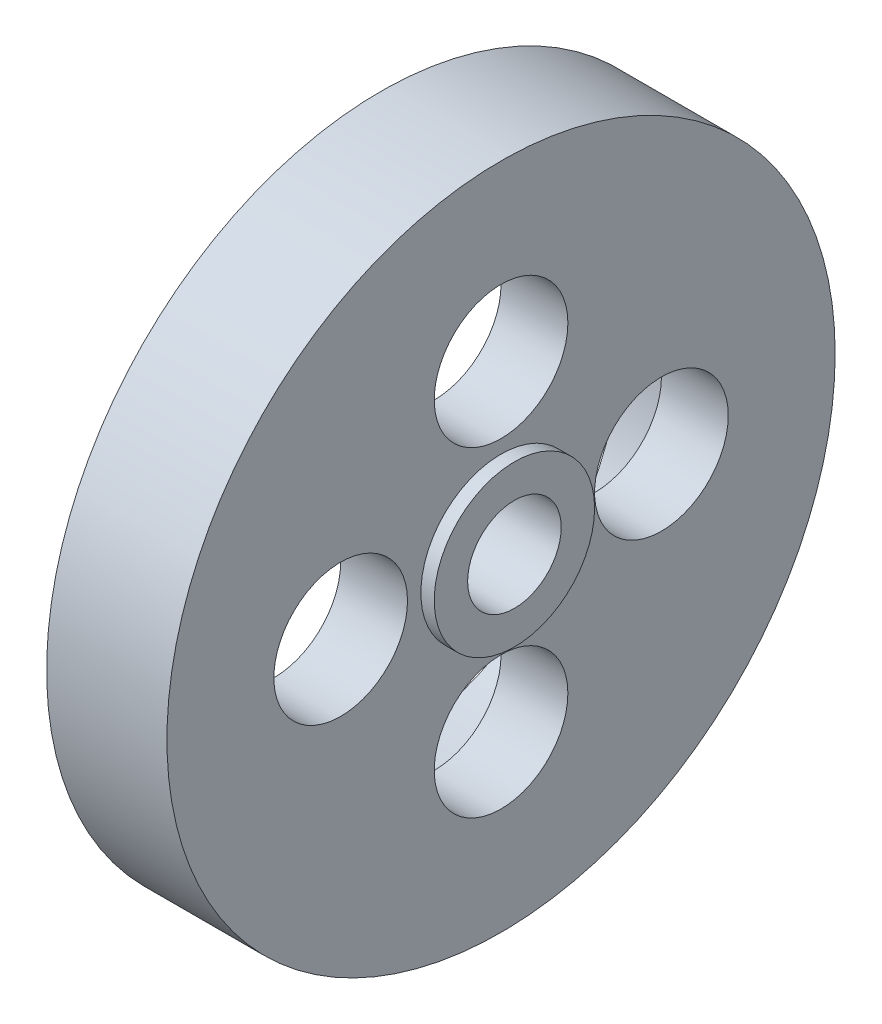
from build123d import *

# Parameters (mm, degrees)
SKETCH1_R           = 25
SKETCH1_R_2         = 3.5
BOSS_EXTRUDE1_DEPTH = 10
CUT_EXTRUDE2_START  = -1
SKETCH2_R           = 25
SKETCH2_R_2         = 6
CUT_EXTRUDE2_DEPTH  = 1
SKETCH3_R           = 5
CUT_EXTRUDE3_DEPTH  = 37.482872694
SKETCH4_R           = 18
CUT_EXTRUDE4_DEPTH  = 4


with BuildPart() as part:
    # Sketch1 → Boss-Extrude1 (new body)
    with BuildSketch(Plane(origin=(0, 0, 0), x_dir=(0, 0, -1), z_dir=(1, 0, 0))):
        Circle(SKETCH1_R)
        Circle(SKETCH1_R_2, mode=Mode.SUBTRACT)
    extrude(amount=BOSS_EXTRUDE1_DEPTH)

    # Sketch2 → Cut-Extrude2 (cut)
    with BuildSketch(Plane(origin=(10, 0, 0), x_dir=(0, 0, -1), z_dir=(1, 0, 0)).offset(CUT_EXTRUDE2_START)):
        Circle(SKETCH2_R)
        Circle(SKETCH2_R_2, mode=Mode.SUBTRACT)
    extrude(amount=CUT_EXTRUDE2_DEPTH, mode=Mode.SUBTRACT)

    # Sketch3 → Cut-Extrude3 (cut, through all)
    with BuildSketch(Plane(origin=(9, 0, 0), x_dir=(0, 0, -1), z_dir=(1, 0, 0))):
        with Locations((0, 12)):
            Circle(SKETCH3_R)
        with Locations((12, 0)):
            Circle(SKETCH3_R)
        with Locations((0, -12)):
            Circle(SKETCH3_R)
        with Locations((-12, 0)):
            Circle(SKETCH3_R)
    extrude(amount=-CUT_EXTRUDE3_DEPTH, mode=Mode.SUBTRACT)

    # Sketch4 → Cut-Extrude4 (cut)
    with BuildSketch(Plane.ZY):
        Circle(SKETCH4_R)
    extrude(amount=-CUT_EXTRUDE4_DEPTH, mode=Mode.SUBTRACT)


solid = part.part
